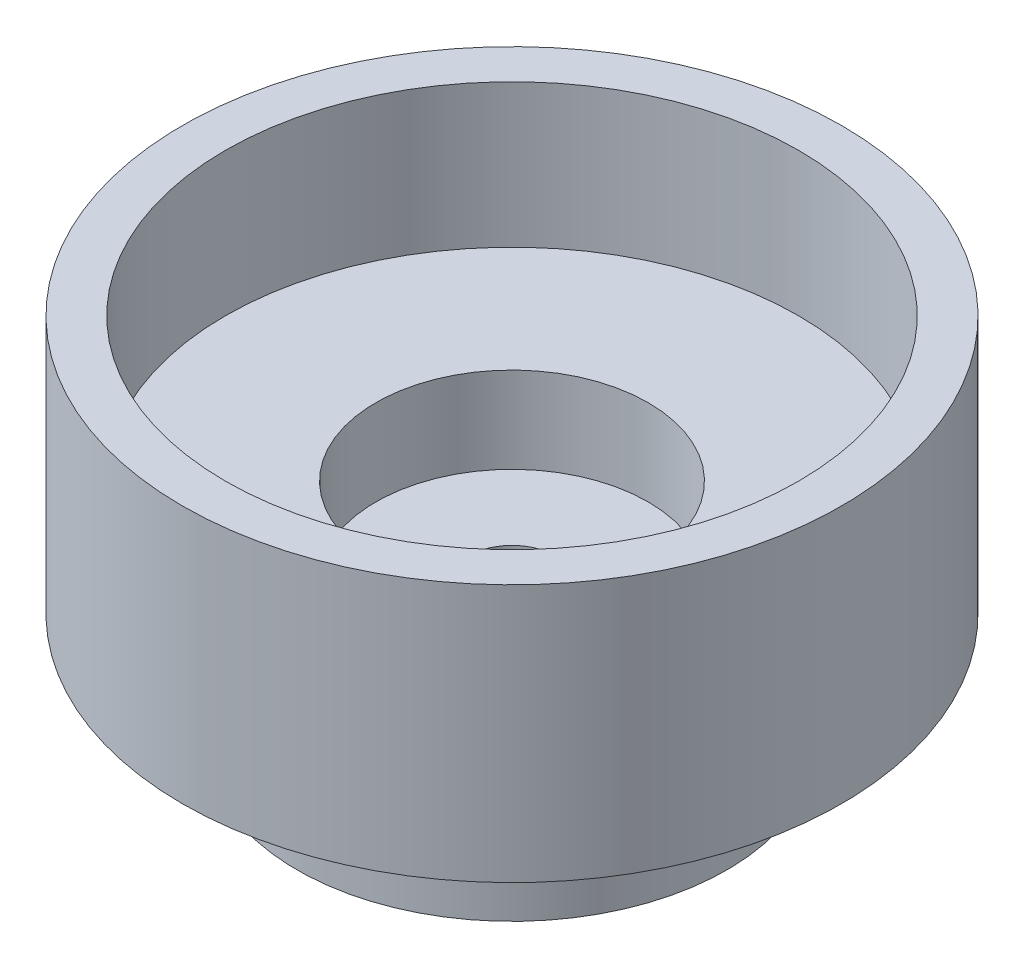
from build123d import *

# Parameters (mm, degrees)
SKETCH_1_R           = 23
EXTRUDE_1_DEPTH      = 26
SKETCH_7_R           = 23
SKETCH_7_R_2         = 15
CUT_EXTRUDE_5_DEPTH  = 8
SKETCH_8_R           = 9.5
CUT_EXTRUDE_6_DEPTH  = 6
SKETCH_9_R           = 3
CUT_EXTRUDE_7_DEPTH  = 24.5
SKETCH_10_R          = 20
CUT_EXTRUDE_8_DEPTH  = 10
CUT_EXTRUDE_START    = -6
SKETCH_11_R          = 9.5
CUT_EXTRUDE_10_DEPTH = 6


with BuildPart() as part:
    # 스케치1 → 보스-돌출1 (new body)
    with BuildSketch(Plane(origin=(0, 0, 0), x_dir=(1, 0, 0), z_dir=(0, 1, 0))):
        with Locations(Location((0, 0, 0), (0, 0, 90))):
            Circle(SKETCH_1_R)
    extrude(amount=EXTRUDE_1_DEPTH)

    # 스케치7 → 컷-돌출5 (cut)
    with BuildSketch(Plane(origin=(0, 0, 0), x_dir=(-1, 0, 0), z_dir=(0, -1, 0))):
        with Locations(Location((0, 0, 0), (0, 0, 90))):
            Circle(SKETCH_7_R)
        with Locations(Location((0, 0, 0), (0, 0, 90))):
            Circle(SKETCH_7_R_2, mode=Mode.SUBTRACT)
    extrude(amount=-CUT_EXTRUDE_5_DEPTH, mode=Mode.SUBTRACT)

    # 스케치8 → 컷-돌출6 (cut)
    with BuildSketch(Plane.XZ):
        with Locations(Location((0, 0, 0), (0, 0, 270))):
            Circle(SKETCH_8_R)
    extrude(amount=-CUT_EXTRUDE_6_DEPTH, mode=Mode.SUBTRACT)

    # 스케치9 → 컷-돌출7 (cut)
    with BuildSketch(Plane(origin=(0, 26, 0), x_dir=(1, 0, 0), z_dir=(0, 1, 0))):
        with Locations(Location((0, 0, 0), (0, 0, 270))):
            Circle(SKETCH_9_R)
    extrude(amount=-CUT_EXTRUDE_7_DEPTH, mode=Mode.SUBTRACT)

    # 스케치10 → 컷-돌출8 (cut)
    with BuildSketch(Plane(origin=(0, 26, 0), x_dir=(1, 0, 0), z_dir=(0, 1, 0))):
        with Locations(Location((0, 0, 0), (0, 0, 270))):
            Circle(SKETCH_10_R)
    extrude(amount=-CUT_EXTRUDE_8_DEPTH, mode=Mode.SUBTRACT)

    # 스케치11 → 컷-돌출10 (cut)
    with BuildSketch(Plane(origin=(0, 16, 0), x_dir=(1, 0, 0), z_dir=(0, 1, 0)).offset(CUT_EXTRUDE_START)):
        with Locations(Location((0, 0, 0), (0, 0, 90))):
            Circle(SKETCH_11_R)
    extrude(amount=CUT_EXTRUDE_10_DEPTH, mode=Mode.SUBTRACT)


solid = part.part
